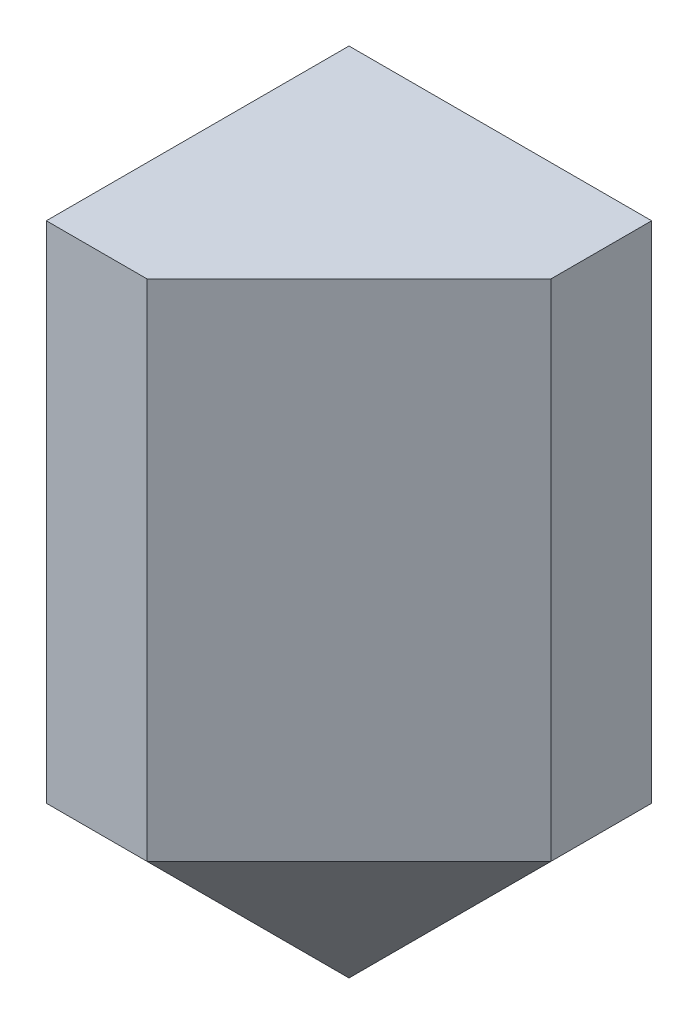
from build123d import *

# Parameters (mm, degrees)
SCHIZZO1_W                   = 30
SCHIZZO1_H                   = 40
ESTRUSIONE_ESTRUSIONE1_DEPTH = 30
SMUSSO1_SIZE                 = 20
ESTRUSIONE_ESTRUSIONE2_DEPTH = 30
FORO_PER_VITE_M5_1_D         = 5.5
FORO_PER_VITE_M5_1_DEPTH     = 15
FORO_PER_VITE_M5_1_TIP       = 1.652366702
FORO_PER_VITE_M5_2_D         = 5.5
FORO_PER_VITE_M5_2_DEPTH     = 15
FORO_PER_VITE_M5_2_TIP       = 1.652366702
SCHIZZO6_R                   = 10
TAGLIO_ESTRUSIONE1_DEPTH     = 2


with BuildPart() as part:
    # Schizzo1 → Estrusione-Estrusione1 (new body)
    with BuildSketch(Plane.XY):
        with Locations((15, 20)):
            Rectangle(SCHIZZO1_W, SCHIZZO1_H)
    extrude(amount=ESTRUSIONE_ESTRUSIONE1_DEPTH)

    # Smusso1
    smusso1_edges = [part.edges().sort_by_distance(p)[0] for p in [
        (30, 20, 30),
        (30, 0, 15),
        (15, 0, 30),
    ]]
    chamfer(smusso1_edges, length=SMUSSO1_SIZE)

    # Schizzo2 → Estrusione-Estrusione2 (add)
    with BuildSketch(Plane(origin=(0, 40, 0), x_dir=(1, 0, 0), z_dir=(0, 1, 0))):
        Polygon((0, 0), (30, 0), (30, -10), (10, -30), (0, -30), align=None)
    extrude(amount=ESTRUSIONE_ESTRUSIONE2_DEPTH)

    # Foro per Vite M5-1
    with Locations(Plane.ZY):
        with Locations((18, 20), (18, 48)):
            Hole(FORO_PER_VITE_M5_1_D / 2, depth=FORO_PER_VITE_M5_1_DEPTH)
            with Locations((0, 0, -(FORO_PER_VITE_M5_1_DEPTH + FORO_PER_VITE_M5_1_TIP / 2))):  # 118° drill point
                Cone(0, FORO_PER_VITE_M5_1_D / 2, FORO_PER_VITE_M5_1_TIP, mode=Mode.SUBTRACT)

    # Foro per Vite M5-2
    with Locations(Plane(origin=(18, 20, 0), x_dir=(-1, 0, 0), z_dir=(0, 0, -1))):
        with Locations((0, 0)):
            Hole(FORO_PER_VITE_M5_2_D / 2, depth=FORO_PER_VITE_M5_2_DEPTH)
            with Locations((0, 0, -(FORO_PER_VITE_M5_2_DEPTH + FORO_PER_VITE_M5_2_TIP / 2))):  # 118° drill point
                Cone(0, FORO_PER_VITE_M5_2_D / 2, FORO_PER_VITE_M5_2_TIP, mode=Mode.SUBTRACT)

    # Schizzo6 → Taglio-Estrusione1 (cut)
    with BuildSketch(Plane(origin=(0, 0, 0), x_dir=(-1, 0, 0), z_dir=(0, 0, -1))):
        with Locations((-15, 55)):
            Circle(SCHIZZO6_R)
    extrude(amount=-TAGLIO_ESTRUSIONE1_DEPTH, mode=Mode.SUBTRACT)


solid = part.part
